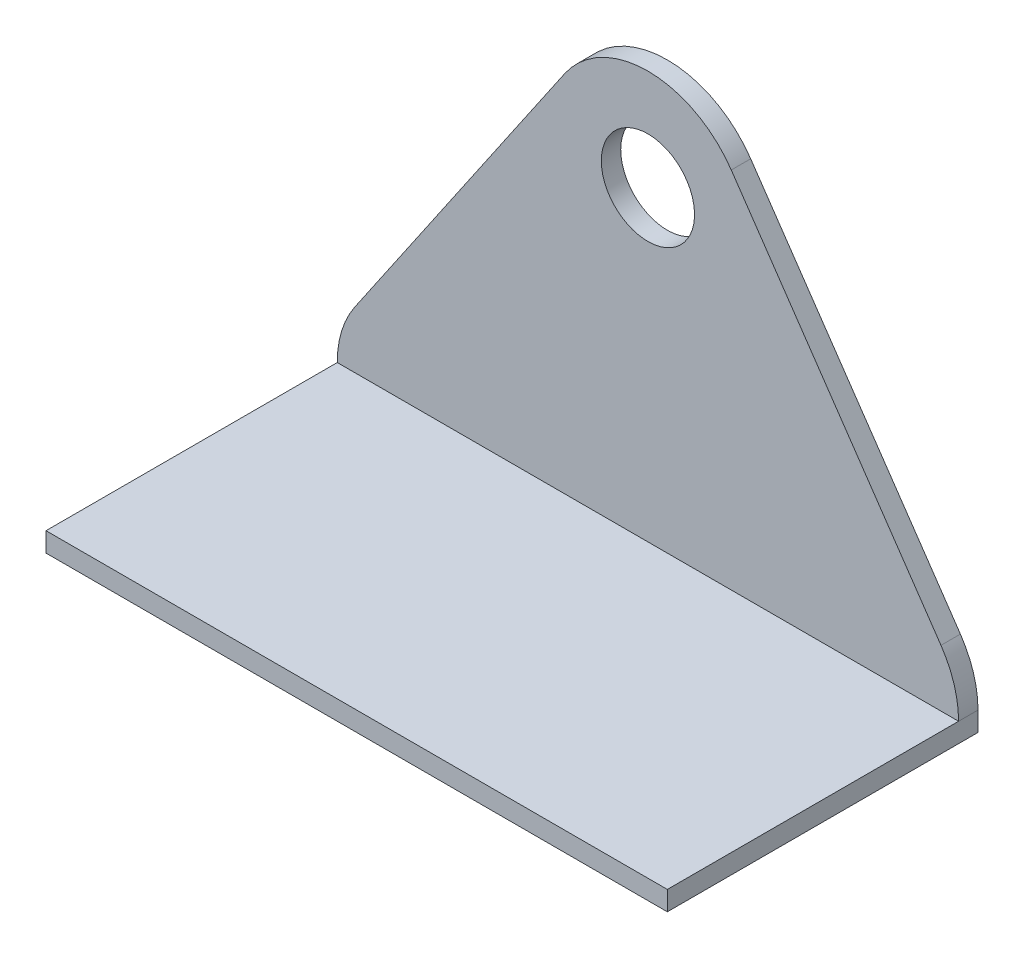
from build123d import *

# Parameters (mm, degrees)
SKETCH1_W           = 80
SKETCH1_H           = 40
BOSS_EXTRUDE1_DEPTH = 2.5
SKETCH3_R           = 6
BOSS_EXTRUDE2_DEPTH = 2.5


with BuildPart() as part:
    # Sketch1 → Boss-Extrude1 (new body)
    with BuildSketch(Plane(origin=(0, 0, 0), x_dir=(1, 0, 0), z_dir=(0, 1, 0))):
        with Locations((40, 20)):
            Rectangle(SKETCH1_W, SKETCH1_H)
    extrude(amount=BOSS_EXTRUDE1_DEPTH)

    # Sketch3 → Boss-Extrude2 (add)
    with BuildSketch(Plane(origin=(0, 0, -40), x_dir=(-1, 0, 0), z_dir=(0, 0, -1))):
        with BuildLine():
            ThreePointArc((0, 2.5), (-0.57985041, 6.339255677), (-2.267674485, 9.836019972))
            Line((-2.267674485, 9.836019972), (-29.267674485, 49.336019972))
            ThreePointArc((-29.267674485, 49.336019972), (-40, 55), (-50.732325515, 49.336019972))
            Line((-50.732325515, 49.336019972), (-77.732325515, 9.836019972))
            ThreePointArc((-77.732325515, 9.836019972), (-79.42014959, 6.339255677), (-80, 2.5))
            Line((-80, 2.5), (0, 2.5))
        make_face()
        with Locations((-40, 42)):
            Circle(SKETCH3_R, mode=Mode.SUBTRACT)
    extrude(amount=-BOSS_EXTRUDE2_DEPTH)


solid = part.part
